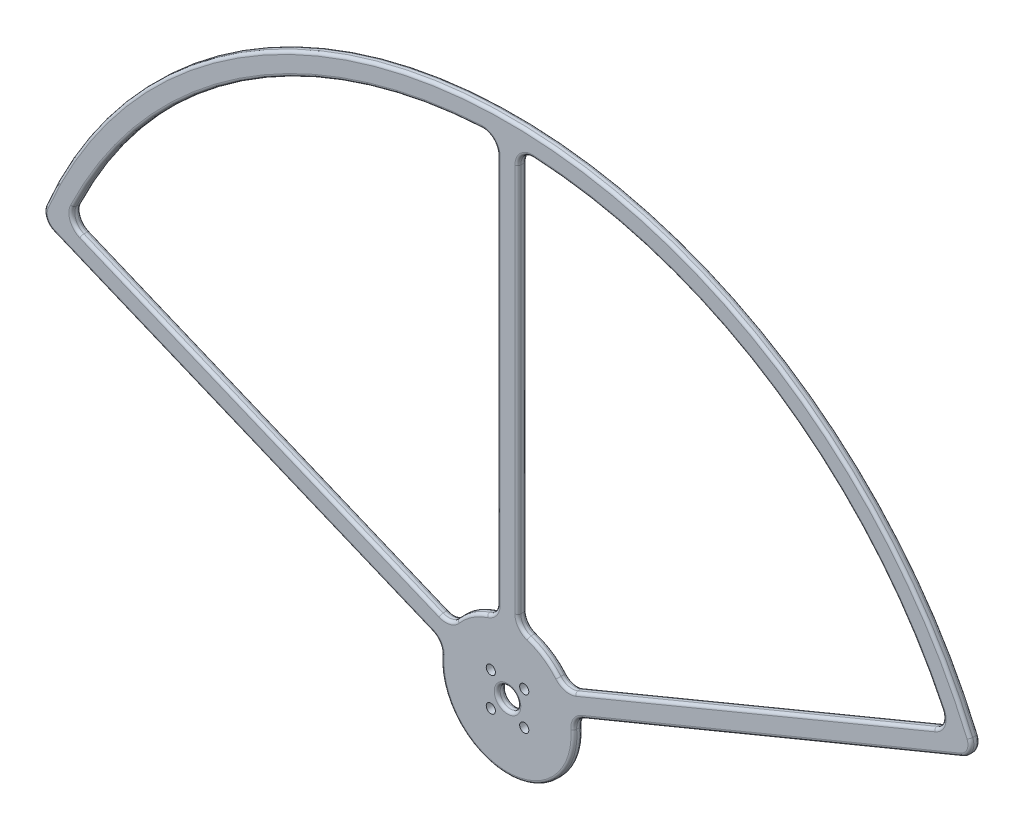
from build123d import *

# Parameters (mm, degrees)
SKETCH_1_R          = 3.5
EXTRUDE_1_DEPTH     = 3
FILLET_1_R          = 1
SKETCH_3_R          = 1.55
CUT_EXTRUDE_1_DEPTH = 3


with BuildPart() as part:
    # 스케치1 → 보스-돌출1 (new body)
    with BuildSketch(Plane.XY):
        with BuildLine():
            Line((153.801652879, 59.832280258), (25.501977123, 6.77489209))
            ThreePointArc((25.501977123, 6.77489209), (23.152294987, 4.768152916), (22.430777142, 1.76358635))
            ThreePointArc((22.430777142, 1.76358635), (0, -22.5), (-22.430777142, 1.76358635))
            ThreePointArc((-22.430777142, 1.76358635), (-23.152294987, 4.768152916), (-25.501977123, 6.77489209))
            Line((-25.501977123, 6.77489209), (-153.526547506, 59.80440546))
            ThreePointArc((-153.526547506, 59.80440546), (-153.575706318, 59.824462594), (-153.625075335, 59.843996605))
            Line((-153.625075335, 59.843996605), (-153.676023706, 59.863843327))
            ThreePointArc((-153.676023706, 59.863843327), (-156.468806345, 62.581348422), (-156.462986931, 66.478069472))
            ThreePointArc((-156.462986931, 66.478069472), (0.039209702, 169.999995478), (156.493635993, 66.405887494))
            ThreePointArc((156.493635993, 66.405887494), (156.517930689, 62.557932696), (153.801652879, 59.832280258))
        make_face()
        Circle(SKETCH_1_R, mode=Mode.SUBTRACT)
        with BuildLine():
            Line((-3.5, 26.153393661), (-3.5, 157.77119509))
            ThreePointArc((-3.5, 157.77119509), (-5.060882141, 161.400584619), (-8.768987342, 162.763954428))
            ThreePointArc((-8.768987342, 162.763954428), (-90.557947982, 135.529546805), (-147.018539952, 70.388556672))
            ThreePointArc((-147.018539952, 70.388556672), (-147.177980916, 66.440975134), (-144.42218595, 63.610000829))
            Line((-144.42218595, 63.610000829), (-22.823193096, 13.242048818))
            ThreePointArc((-22.823193096, 13.242048818), (-19.742738046, 12.999551524), (-17.107998492, 14.613910757))
            ThreePointArc((-17.107998492, 14.613910757), (-12.500330243, 18.708066277), (-6.954545455, 21.398231177))
            ThreePointArc((-6.954545455, 21.398231177), (-4.454800825, 23.214624593), (-3.5, 26.153393661))
        make_face(mode=Mode.SUBTRACT)
        with BuildLine():
            Line((3.5, 26.153393661), (3.5, 157.77119509))
            ThreePointArc((3.5, 157.77119509), (5.060882141, 161.400584619), (8.768987342, 162.763954428))
            ThreePointArc((8.768987342, 162.763954428), (90.557947982, 135.529546805), (147.018539952, 70.388556672))
            ThreePointArc((147.018539952, 70.388556672), (147.177980916, 66.440975135), (144.42218595, 63.610000829))
            Line((144.42218595, 63.610000829), (22.823193096, 13.242048818))
            ThreePointArc((22.823193096, 13.242048818), (19.742738046, 12.999551524), (17.107998492, 14.613910757))
            ThreePointArc((17.107998492, 14.613910757), (12.500330243, 18.708066277), (6.954545455, 21.398231177))
            ThreePointArc((6.954545455, 21.398231177), (4.454800825, 23.214624593), (3.5, 26.153393661))
        make_face(mode=Mode.SUBTRACT)
    extrude(amount=EXTRUDE_1_DEPTH)

    # 필렛1
    fillet_1_edges = [part.edges().sort_by_distance(p)[0] for p in [
        (-156.468806345, 62.581348422, 3),
        (0, -22.5, 0),
        (-23.152294987, 4.768152916, 0),
        (-89.514262314, 33.289648775, 0),
        (-153.575706318, 59.824462594, 0),
        (-153.650549521, 59.853919966, 0),
        (-156.468806345, 62.581348422, 0),
        (0.039209702, 169.999995478, 0),
        (156.517930689, 62.557932696, 0),
        (-153.650549521, 59.853919966, 3),
        (-153.575706318, 59.824462594, 3),
        (-89.514262314, 33.289648775, 3),
        (-23.152294987, 4.768152916, 3),
        (0, -22.5, 3),
        (-3.5, 0, 0),
        (-3.5, 0, 3),
        (23.152294987, 4.768152916, 3),
        (89.651815001, 33.303586174, 3),
        (-147.177980916, 66.440975134, 0),
        (-83.622689523, 38.426024824, 0),
        (-19.742738046, 12.999551524, 0),
        (-12.500330243, 18.708066277, 0),
        (-4.454800825, 23.214624593, 0),
        (-3.5, 91.962294375, 0),
        (-5.060882141, 161.400584619, 0),
        (-90.557947982, 135.529546805, 0),
        (-147.177980916, 66.440975134, 3),
        (-83.622689523, 38.426024824, 3),
        (-19.742738046, 12.999551524, 3),
        (-12.500330243, 18.708066277, 3),
        (-4.454800825, 23.214624593, 3),
        (-3.5, 91.962294375, 3),
        (156.517930689, 62.557932696, 3),
        (-5.060882141, 161.400584619, 3),
        (-90.557947982, 135.529546805, 3),
        (5.060882141, 161.400584619, 0),
        (3.5, 91.962294375, 0),
        (4.454800825, 23.214624593, 0),
        (12.500330243, 18.708066277, 0),
        (19.742738046, 12.999551524, 0),
        (83.622689523, 38.426024824, 0),
        (147.177980916, 66.440975135, 0),
        (90.557947982, 135.529546805, 0),
        (5.060882141, 161.400584619, 3),
        (3.5, 91.962294375, 3),
        (4.454800825, 23.214624593, 3),
        (12.500330243, 18.708066277, 3),
        (19.742738046, 12.999551524, 3),
        (83.622689523, 38.426024824, 3),
        (147.177980916, 66.440975135, 3),
        (90.557947982, 135.529546805, 3),
        (0.039209702, 169.999995478, 3),
        (89.651815001, 33.303586174, 0),
        (23.152294987, 4.768152916, 0),
    ]]
    fillet(fillet_1_edges, radius=FILLET_1_R)

    # 스케치3 → 컷-돌출1 (cut)
    with BuildSketch(Plane(origin=(0, 0, 0), x_dir=(-1, 0, 0), z_dir=(0, 0, -1))):
        with Locations((-5.656854249, 5.656854249)):
            Circle(SKETCH_3_R)
        with Locations((5.656854249, 5.656854249)):
            Circle(SKETCH_3_R)
        with Locations((5.656854249, -5.656854249)):
            Circle(SKETCH_3_R)
        with Locations((-5.656854249, -5.656854249)):
            Circle(SKETCH_3_R)
    extrude(amount=-CUT_EXTRUDE_1_DEPTH, mode=Mode.SUBTRACT)


solid = part.part
